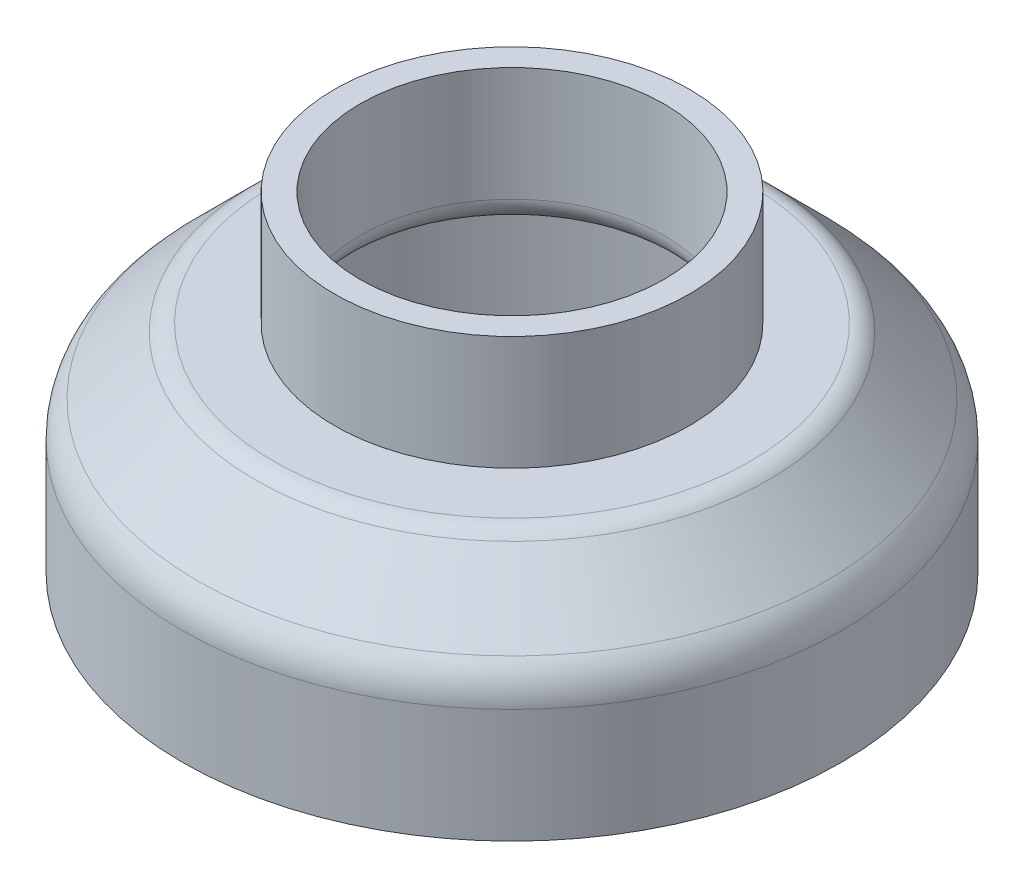
from build123d import *


with BuildPart() as part:
    # Esquisse1 → Révolution1 (revolve)
    with BuildSketch(Plane.XY, mode=Mode.PRIVATE) as r_volution1_sk:
        with BuildLine():
            Line((7, 51.583866339), (7, 47.083866339))
            Line((7, 47.083866339), (9.414213562, 47.083866339))
            ThreePointArc((9.414213562, 47.083866339), (9.796896995, 47.007745871), (10.121320344, 46.79097312))
            Line((10.121320344, 46.79097312), (12.414213562, 44.498079901))
            ThreePointArc((12.414213562, 44.498079901), (12.847759065, 43.849233203), (13, 43.083866339))
            Line((13, 43.083866339), (13, 38.583866339))
            Line((13, 38.583866339), (12, 38.583866339))
            Line((12, 38.583866339), (12, 43.083866339))
            ThreePointArc((12, 43.083866339), (11.923879533, 43.466549771), (11.707106781, 43.79097312))
            Line((11.707106781, 43.79097312), (9.414213562, 46.083866339))
            Line((9.414213562, 46.083866339), (7, 46.083866339))
            ThreePointArc((7, 46.083866339), (6.292893219, 46.376759557), (6, 47.083866339))
            Line((6, 47.083866339), (6, 51.583866339))
            Line((6, 51.583866339), (7, 51.583866339))
        make_face()
    revolve(r_volution1_sk.sketch.rotate(Axis((0, 0, 0), (0, 1, 0)), 90), axis=Axis((0, 0, 0), (0, 1, 0)))


solid = part.part
